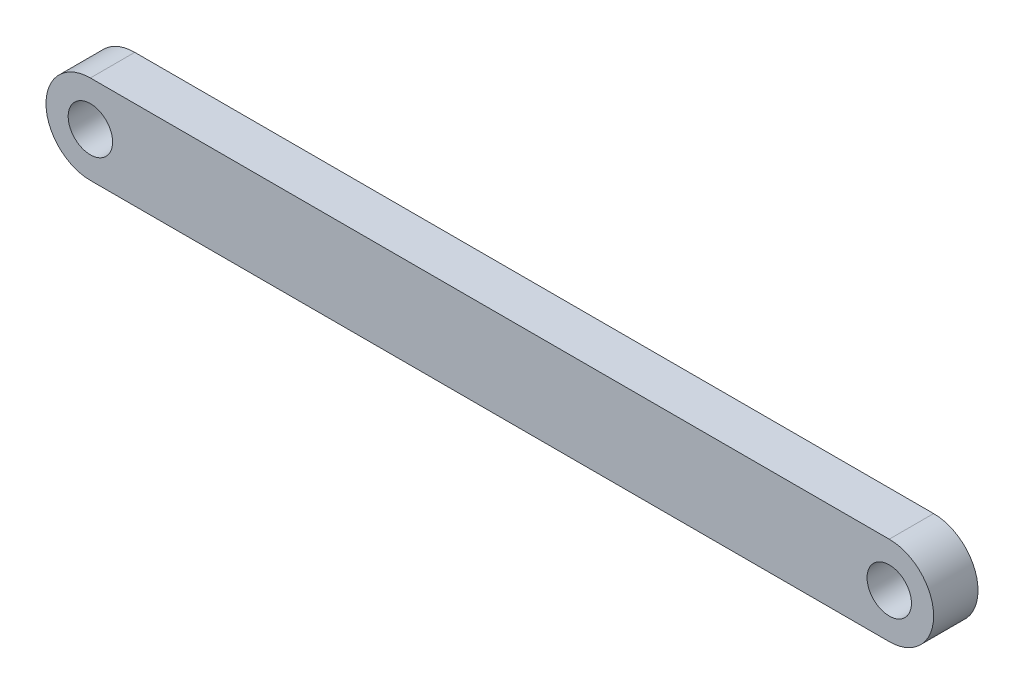
from build123d import *

# Parameters (mm, degrees)
BOSS_EXTRUDE1_DEPTH      = 1.27
BOSS_EXTRUDE1_DEPTH_BACK = 1.27
SKETCH1_R                = 1.27


with BuildPart() as part:
    # Sketch1 → Boss-Extrude1 (new, two sides: drawn at the far end of the back side and taken through both)
    with BuildSketch(Plane.XY.offset(-BOSS_EXTRUDE1_DEPTH_BACK)):
        with BuildLine():
            Line((-22.86, 2.54), (22.86, 2.54))
            ThreePointArc((22.86, 2.54), (25.4, 0), (22.86, -2.54))
            Line((22.86, -2.54), (-22.86, -2.54))
            ThreePointArc((-22.86, -2.54), (-25.4, 0), (-22.86, 2.54))
        make_face()
        with Locations((-22.86, 0)):
            Circle(SKETCH1_R, mode=Mode.SUBTRACT)
        with Locations((22.86, 0)):
            Circle(SKETCH1_R, mode=Mode.SUBTRACT)
    extrude(amount=BOSS_EXTRUDE1_DEPTH + BOSS_EXTRUDE1_DEPTH_BACK)


solid = part.part
